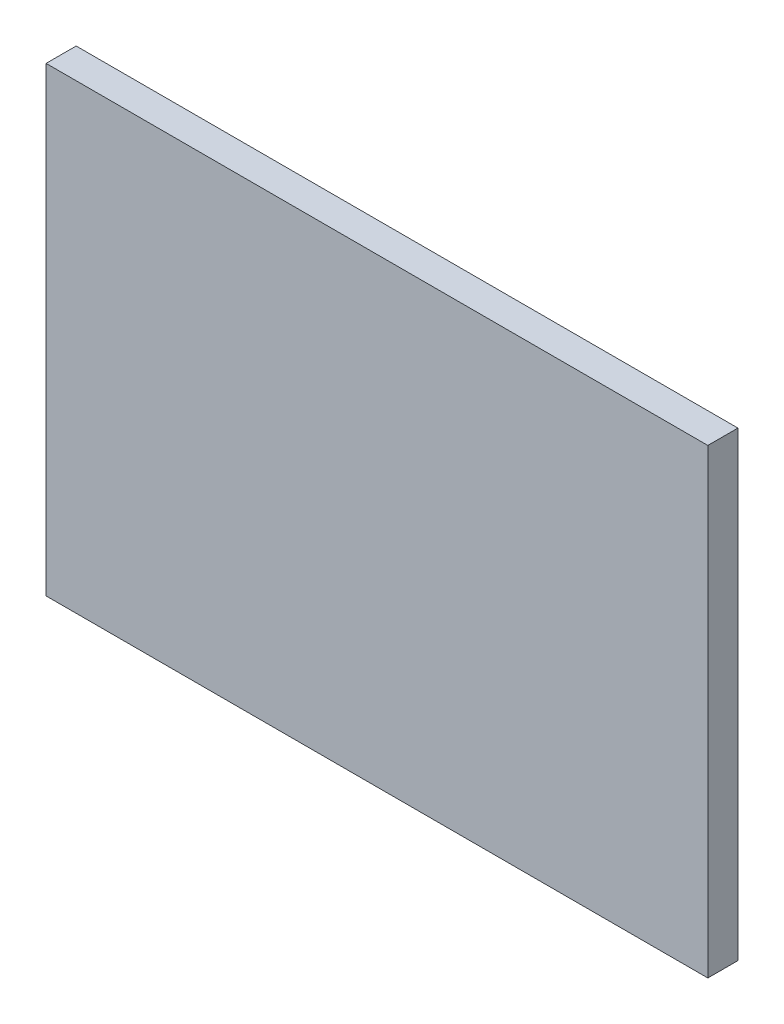
from build123d import *

# Parameters (mm, degrees)
SKETCH1_W           = 66
SKETCH1_H           = 46
BOSS_EXTRUDE1_DEPTH = 3


with BuildPart() as part:
    # Sketch1 → Boss-Extrude1 (new body)
    with BuildSketch(Plane.XY):
        Rectangle(SKETCH1_W, SKETCH1_H)
    extrude(amount=BOSS_EXTRUDE1_DEPTH)


solid = part.part
